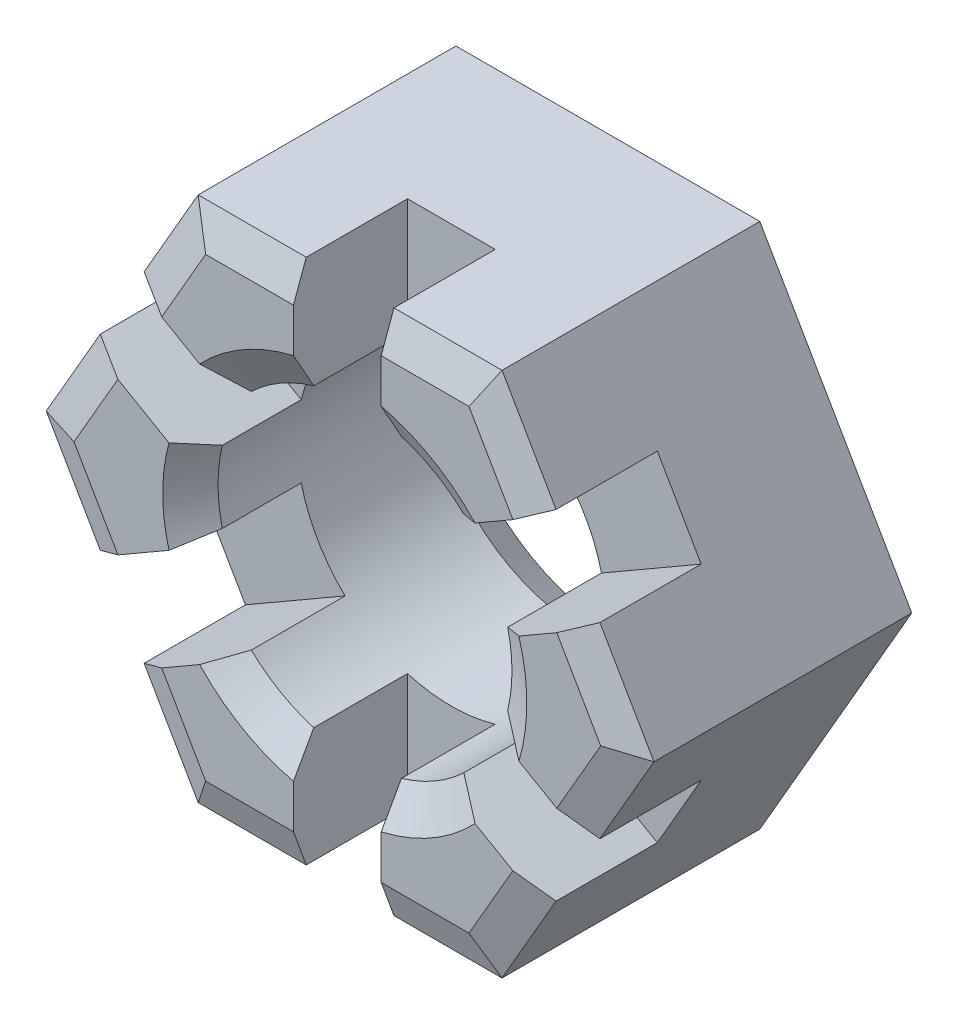
from build123d import *
from OCP.BRepFilletAPI import BRepFilletAPI_MakeChamfer

# Parameters (mm, degrees)
RESSALTO_EXTRUS_O1_DEPTH = 16
CHANFRO1_SIZE            = 2
CHANFRO1_SIZE2           = 0.727940469
ESBO_O2_R                = 8.8
CORTE_EXTRUS_O1_DEPTH    = 16
ESBO_O3_W                = 5
ESBO_O3_H                = 10
CORTE_EXTRUS_O2_DEPTH    = 6.5
CHANFRO2_SIZE            = 2
CHANFRO2_SIZE2           = 1.154700538
CHANFRO3_SIZE            = 2
CHANFRO3_SIZE2           = 1.154700538
CHANFRO5_SIZE            = 1
CHANFRO5_SIZE2           = 0.577350269


with BuildPart() as part:
    # Esboço1 → Ressalto-extrusão1 (new body)
    with BuildSketch(Plane.XY):
        Polygon((17.320508076, 0), (8.660254038, 15), (-8.660254038, 15), (-17.320508076, 0), (-8.660254038, -15), (8.660254038, -15), align=None)
    extrude(amount=RESSALTO_EXTRUS_O1_DEPTH)

    # Chanfro1
    chanfro1_edges = [part.edges().sort_by_distance(p)[0] for p in [
        (0, 15, 16),
        (-12.990381057, 7.5, 16),
        (-12.990381057, -7.5, 16),
        (0, -15, 16),
        (12.990381057, -7.5, 16),
        (12.990381057, 7.5, 16),
    ]]
    chanfro1_side = [part.faces().sort_by_distance(p)[0] for p in [
        (0, 0, 16),
    ]]
    chamfer(chanfro1_edges, length=CHANFRO1_SIZE, length2=CHANFRO1_SIZE2, reference=chanfro1_side[0])

    # Esboço2 → Corte-extrusão1 (cut)
    with BuildSketch(Plane.XY.offset(16)):
        Circle(ESBO_O2_R)
    extrude(amount=-CORTE_EXTRUS_O1_DEPTH, mode=Mode.SUBTRACT)

    # Esboço3 → Corte-extrusão2 (cut)
    with BuildSketch(Plane.XY.offset(16)):
        Polygon((13.353868008, 10.596610635), (15.853868008, 6.266483616), (7.19361397, 1.266483616), (4.69361397, 5.596610635), align=None)
        with Locations((0, 11.863094251)):
            Rectangle(ESBO_O3_W, ESBO_O3_H)
        Polygon((15.853868008, -6.266483616), (13.353868008, -10.596610635), (4.69361397, -5.596610635), (7.19361397, -1.266483616), align=None)
        with Locations((0, -11.863094251)):
            Rectangle(ESBO_O3_W, ESBO_O3_H)
        Polygon((-13.353868008, -10.596610635), (-15.853868008, -6.266483616), (-7.19361397, -1.266483616), (-4.69361397, -5.596610635), align=None)
        Polygon((-15.853868008, 6.266483616), (-13.353868008, 10.596610635), (-4.69361397, 5.596610635), (-7.19361397, 1.266483616), align=None)
    extrude(amount=-CORTE_EXTRUS_O2_DEPTH, mode=Mode.SUBTRACT)

    # Chanfro2: one chamfer whose edges measure the first distance from different faces: ONE call of the kernel's chamfer builder (chamfer() names one face for all edges)
    chanfro2_edges_1 = [part.edges().sort_by_distance(p)[0] for p in [
        (4.4, -7.621023553, 16),
    ]]
    chanfro2_side_1 = [part.faces().sort_by_distance(p)[0] for p in [
        (5.798091402, -10.042588894, 16),
    ]]
    chanfro2_edges_2 = [part.edges().sort_by_distance(p)[0] for p in [
        (-4.4, -7.621023553, 16),
    ]]
    chanfro2_side_2 = [part.faces().sort_by_distance(p)[0] for p in [
        (-5.798091402, -10.042588894, 16),
    ]]
    chanfro2_edges_3 = [part.edges().sort_by_distance(p)[0] for p in [
        (-8.8, 0, 16),
    ]]
    chanfro2_side_3 = [part.faces().sort_by_distance(p)[0] for p in [
        (-8.8, 0, 8),
    ]]
    chanfro2_edges_4 = [part.edges().sort_by_distance(p)[0] for p in [
        (-4.4, 7.621023553, 16),
    ]]
    chanfro2_side_4 = [part.faces().sort_by_distance(p)[0] for p in [
        (-5.798091402, 10.042588894, 16),
    ]]
    chanfro2_edges_5 = [part.edges().sort_by_distance(p)[0] for p in [
        (4.4, 7.621023553, 16),
    ]]
    chanfro2_side_5 = [part.faces().sort_by_distance(p)[0] for p in [
        (5.798091402, 10.042588894, 16),
    ]]
    chanfro2_edges_6 = [part.edges().sort_by_distance(p)[0] for p in [
        (8.739043173, 1.033984733, 16),
    ]]
    chanfro2_side_6 = [part.faces().sort_by_distance(p)[0] for p in [
        (11.596182803, 0, 16),
    ]]
    chanfro2 = BRepFilletAPI_MakeChamfer(part.part.solid().wrapped)
    for e in chanfro2_edges_1:
        chanfro2.Add(CHANFRO2_SIZE, CHANFRO2_SIZE2, e.wrapped, chanfro2_side_1[0].wrapped)  # the first distance lies on this face
    for e in chanfro2_edges_2:
        chanfro2.Add(CHANFRO2_SIZE, CHANFRO2_SIZE2, e.wrapped, chanfro2_side_2[0].wrapped)  # the first distance lies on this face
    for e in chanfro2_edges_3:
        chanfro2.Add(CHANFRO2_SIZE, CHANFRO2_SIZE2, e.wrapped, chanfro2_side_3[0].wrapped)  # the first distance lies on this face
    for e in chanfro2_edges_4:
        chanfro2.Add(CHANFRO2_SIZE, CHANFRO2_SIZE2, e.wrapped, chanfro2_side_4[0].wrapped)  # the first distance lies on this face
    for e in chanfro2_edges_5:
        chanfro2.Add(CHANFRO2_SIZE, CHANFRO2_SIZE2, e.wrapped, chanfro2_side_5[0].wrapped)  # the first distance lies on this face
    for e in chanfro2_edges_6:
        chanfro2.Add(CHANFRO2_SIZE, CHANFRO2_SIZE2, e.wrapped, chanfro2_side_6[0].wrapped)  # the first distance lies on this face
    add(Compound.cast(chanfro2.Shape()), mode=Mode.REPLACE)

    # Chanfro3
    chanfro3_edges = [part.edges().sort_by_distance(p)[0] for p in [
        (-8.8, 0, 0),
    ]]
    chanfro3_side = [part.faces().sort_by_distance(p)[0] for p in [
        (-8.8, 0, 7.422649731),
    ]]
    chamfer(chanfro3_edges, length=CHANFRO3_SIZE, length2=CHANFRO3_SIZE2, reference=chanfro3_side[0])

    # Chanfro5
    chanfro5_edges = [part.edges().sort_by_distance(p)[0] for p in [
        (0, -15, 0),
        (-12.990381057, -7.5, 0),
        (-12.990381057, 7.5, 0),
        (0, 15, 0),
        (12.990381057, 7.5, 0),
        (12.990381057, -7.5, 0),
    ]]
    chanfro5_side = [part.faces().sort_by_distance(p)[0] for p in [
        (-10.412958108, 0, 0),
    ]]
    chamfer(chanfro5_edges, length=CHANFRO5_SIZE, length2=CHANFRO5_SIZE2, reference=chanfro5_side[0])


solid = part.part
